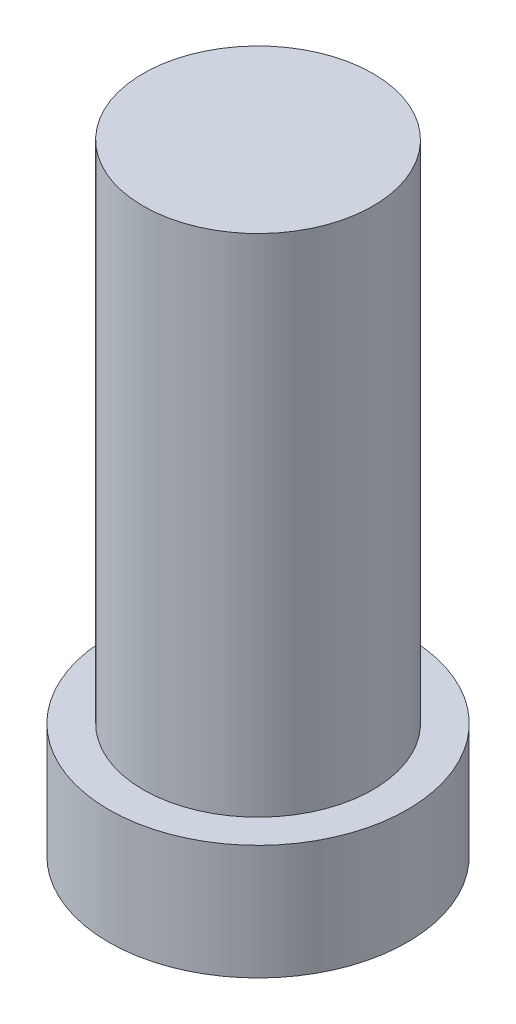
from build123d import *

# Parameters (mm, degrees)
SKETCH_1_R          = 6.5
EXTRUDE_1_DEPTH     = 5
SKETCH_2_R          = 5
EXTRUDE_2_DEPTH     = 22
SKETCH_3_W          = 3.533433272
SKETCH_3_H          = 10.200531816
CUT_EXTRUDE_1_DEPTH = 3


with BuildPart() as part:
    # 草图1 → 凸台-拉伸1 (new body)
    with BuildSketch(Plane(origin=(0, 0, 0), x_dir=(1, 0, 0), z_dir=(0, 1, 0))):
        with Locations(Location((0, 0, 0), (0, 0, 270))):
            Circle(SKETCH_1_R)
    extrude(amount=EXTRUDE_1_DEPTH)

    # 草图2 → 凸台-拉伸2 (add)
    with BuildSketch(Plane(origin=(0, 5, 0), x_dir=(1, 0, 0), z_dir=(0, 1, 0))):
        with Locations(Location((0, 0, 0), (0, 0, 270))):
            Circle(SKETCH_2_R)
    extrude(amount=EXTRUDE_2_DEPTH)

    # 草图3 → 切除-拉伸1 (cut)
    with BuildSketch(Plane(origin=(0, 0, 0), x_dir=(-1, 0, 0), z_dir=(0, -1, 0))):
        Rectangle(SKETCH_3_W, SKETCH_3_H)
    extrude(amount=-CUT_EXTRUDE_1_DEPTH, mode=Mode.SUBTRACT)


solid = part.part
